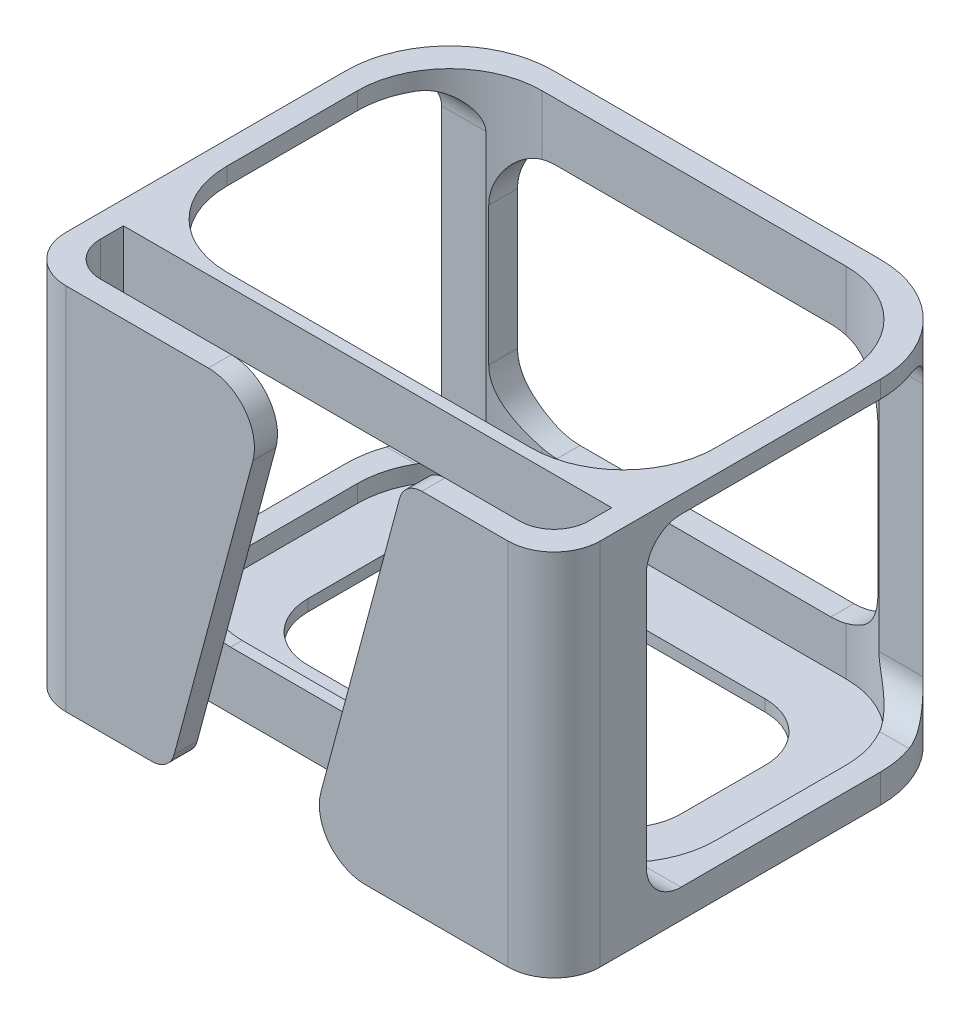
from build123d import *

# Parameters (mm, degrees)
BOSS_EXTRUDE5_DEPTH = 32
CUT_EXTRUDE1_DEPTH  = 31
CUT_EXTRUDE2_DEPTH  = 45.879317341
CUT_EXTRUDE3_START  = -15
CUT_EXTRUDE3_DEPTH  = 2
FILLET1_R           = 4
FILLET2_R           = 2
CUT_EXTRUDE4_DEPTH  = 77.779196401
CUT_EXTRUDE5_DEPTH  = 55


with BuildPart() as part:
    # Sketch1 → Boss-Extrude5 (new body)
    with BuildSketch(Plane(origin=(0, 0, 0), x_dir=(1, 0, 0), z_dir=(0, 1, 0))):
        with BuildLine():
            Line((-0.399762594, -21.65), (18.175, -21.65))
            ThreePointArc((18.175, -21.65), (21.003427125, -20.478427125), (22.175, -17.65))
            Line((22.175, -17.65), (22.175, -8.65))
            Line((22.175, -8.65), (22.175, 6.65))
            ThreePointArc((22.175, 6.65), (19.538961031, 13.013961031), (13.175, 15.65))
            Line((13.175, 15.65), (-15.175, 15.65))
            ThreePointArc((-15.175, 15.65), (-21.538961031, 13.013961031), (-24.175, 6.65))
            Line((-24.175, 6.65), (-24.175, -8.65))
            Line((-24.175, -8.65), (-24.175, -17.65))
            ThreePointArc((-24.175, -17.65), (-23.003427125, -20.478427125), (-20.175, -21.65))
            Line((-20.175, -21.65), (-1.758134267, -21.65))
            Line((-1.758134267, -21.65), (-1.758134267, -19.65))
            Line((-1.758134267, -19.65), (-19.175, -19.65))
            ThreePointArc((-19.175, -19.65), (-21.296320344, -18.771320344), (-22.175, -16.65))
            Line((-22.175, -16.65), (-22.175, -14.65))
            Line((-22.175, -14.65), (20.175, -14.65))
            Line((20.175, -14.65), (20.175, -16.65))
            ThreePointArc((20.175, -16.65), (19.296320344, -18.771320344), (17.175, -19.65))
            Line((17.175, -19.65), (-0.399762594, -19.65))
            Line((-0.399762594, -19.65), (-0.399762594, -21.65))
        make_face()
    extrude(amount=BOSS_EXTRUDE5_DEPTH)

    # Sketch6 → Cut-Extrude1 (cut)
    with BuildSketch(Plane(origin=(0, 32, 0), x_dir=(1, 0, 0), z_dir=(0, 1, 0))):
        with BuildLine():
            Line((-14.175, 13.65), (12.175, 13.65))
            ThreePointArc((12.175, 13.65), (17.831854249, 11.306854249), (20.175, 5.65))
            Line((20.175, 5.65), (20.175, -5.65))
            ThreePointArc((20.175, -5.65), (17.831854249, -11.306854249), (12.175, -13.65))
            Line((12.175, -13.65), (-14.175, -13.65))
            ThreePointArc((-14.175, -13.65), (-19.831854249, -11.306854249), (-22.175, -5.65))
            Line((-22.175, -5.65), (-22.175, 5.65))
            ThreePointArc((-22.175, 5.65), (-19.831854249, 11.306854249), (-14.175, 13.65))
        make_face()
    extrude(amount=-CUT_EXTRUDE1_DEPTH, mode=Mode.SUBTRACT)

    # Sketch9 → Cut-Extrude2 (cut, through all)
    with BuildSketch(Plane(origin=(0, 1, 0), x_dir=(1, 0, 0), z_dir=(0, 1, 0))):
        with BuildLine():
            Line((-12.175, 8.65), (10.175, 8.65))
            ThreePointArc((10.175, 8.65), (13.710533906, 7.185533906), (15.175, 3.65))
            Line((15.175, 3.65), (15.175, -3.65))
            ThreePointArc((15.175, -3.65), (13.710533906, -7.185533906), (10.175, -8.65))
            Line((10.175, -8.65), (-12.175, -8.65))
            ThreePointArc((-12.175, -8.65), (-15.710533906, -7.185533906), (-17.175, -3.65))
            Line((-17.175, -3.65), (-17.175, 3.65))
            ThreePointArc((-17.175, 3.65), (-15.710533906, 7.185533906), (-12.175, 8.65))
        make_face()
    extrude(amount=-CUT_EXTRUDE2_DEPTH, mode=Mode.SUBTRACT)

    # Sketch11 → Cut-Extrude3 (cut)
    with BuildSketch(Plane.XY.offset(34.65).offset(CUT_EXTRUDE3_START)):
        Polygon((-2.600625842, 32), (-11.175, 0), (0.600625842, 0), (9.175, 32), align=None)
    extrude(amount=CUT_EXTRUDE3_DEPTH, mode=Mode.SUBTRACT)

    # Fillet1
    fillet1_edges = [part.edges().sort_by_distance(p)[0] for p in [
        (0.600625842, 0, 20.65),
        (-2.600625842, 32, 20.65),
    ]]
    fillet(fillet1_edges, radius=FILLET1_R)

    # Fillet2
    fillet2_edges = [part.edges().sort_by_distance(p)[0] for p in [
        (9.175, 32, 20.65),
        (-11.175, 0, 20.65),
    ]]
    fillet(fillet2_edges, radius=FILLET2_R)

    # Sketch13 → Cut-Extrude4 (cut, through all)
    with BuildSketch(Plane.ZY.offset(44.175)):
        with BuildLine():
            Line((-9.65, 30.5), (10.65, 30.5))
            ThreePointArc((10.65, 30.5), (12.771320344, 29.621320344), (13.65, 27.5))
            Line((13.65, 27.5), (13.65, 5.5))
            ThreePointArc((13.65, 5.5), (12.771320344, 3.378679656), (10.65, 2.5))
            Line((10.65, 2.5), (-9.65, 2.5))
            ThreePointArc((-9.65, 2.5), (-11.771320344, 3.378679656), (-12.65, 5.5))
            Line((-12.65, 5.5), (-12.65, 27.5))
            ThreePointArc((-12.65, 27.5), (-11.771320344, 29.621320344), (-9.65, 30.5))
        make_face()
    extrude(amount=-CUT_EXTRUDE4_DEPTH, mode=Mode.SUBTRACT)

    # Sketch14 → Cut-Extrude5 (cut)
    with BuildSketch(Plane(origin=(0, 0, -35.65), x_dir=(-1, 0, 0), z_dir=(0, 0, -1))):
        with BuildLine():
            Line((-10.883203932, 27), (12.883203932, 27))
            ThreePointArc((12.883203932, 27), (16.418737838, 25.535533906), (17.883203932, 22))
            Line((17.883203932, 22), (17.883203932, 10))
            ThreePointArc((17.883203932, 10), (16.418737838, 6.464466094), (12.883203932, 5))
            Line((12.883203932, 5), (-10.883203932, 5))
            ThreePointArc((-10.883203932, 5), (-14.418737838, 6.464466094), (-15.883203932, 10))
            Line((-15.883203932, 10), (-15.883203932, 22))
            ThreePointArc((-15.883203932, 22), (-14.418737838, 25.535533906), (-10.883203932, 27))
        make_face()
    extrude(amount=-CUT_EXTRUDE5_DEPTH, mode=Mode.SUBTRACT)


solid = part.part
